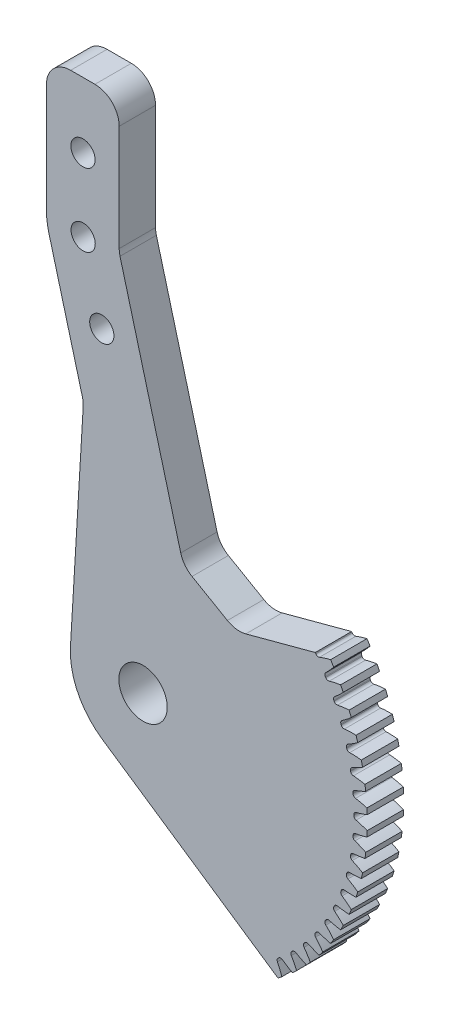
from build123d import *

# Parameters (mm, degrees)
SKETCH2_R                   = 60.325
BOSS_EXTRUDE2_DEPTH         = 4.7625
BOSS_EXTRUDE3_DEPTH         = 9.525
SKETCH4_W                   = 19.05
SKETCH4_H                   = 34.925
BOSS_EXTRUDE4_DEPTH         = 9.525
BOSS_EXTRUDE5_DEPTH         = 9.525
F_1_2_0_5_DIAMETER_HOLE1_D  = 12.6746
CUT_EXTRUDE1_DEPTH          = 146.316463062
CUT_EXTRUDE2_DEPTH          = 146.316463062
CUT_EXTRUDE3_DEPTH          = 12.7
F_1_4_0_25_DIAMETER_HOLE1_D = 6.35
FILLET1_R                   = 6.35
CUT_EXTRUDE4_DEPTH          = 1.5875
CUT_EXTRUDE5_DEPTH          = 1.5875
FILLET2_R                   = 0.79375


with BuildPart() as part:
    # Sketch2 → Boss-Extrude2 (new, symmetric)
    with BuildSketch(Plane.XY):
        with Locations(Location((0, 0, 0), (0, 0, 180))):
            Circle(SKETCH2_R)
    extrude(amount=BOSS_EXTRUDE2_DEPTH, both=True)

    # Sketch3 → Boss-Extrude3 (add)
    with BuildSketch(Plane.XY.offset(4.7625)):
        with BuildLine():
            Line((-15.613258896, 58.269475471), (-24.652514046, 92.004434954))
            Line((-24.652514046, 92.004434954), (-6.251627055, 96.934937763))
            Line((-6.251627055, 96.934937763), (3.586569747, 60.218287442))
            ThreePointArc((3.586569747, 60.218287442), (-6.091779707, 60.016629737), (-15.613258896, 58.269475471))
        make_face()
    extrude(amount=-BOSS_EXTRUDE3_DEPTH)



with BuildPart() as body_2:
    # Sketch4 → Boss-Extrude4 (new body)
    with BuildSketch(Plane.XY.offset(4.7625)):
        with Locations((-15.776627055, 114.397437763)):
            Rectangle(SKETCH4_W, SKETCH4_H)
    extrude(amount=-BOSS_EXTRUDE4_DEPTH)


with BuildPart() as part_1:
    add(part.part)

    add(body_2.part)  # Boss-Extrude5 merges body 2
    # Sketch5 → Boss-Extrude5 (add)
    with BuildSketch(Plane.XY.offset(4.7625)):
        with BuildLine():
            Line((-25.301627055, 96.934937763), (-6.251627055, 96.934937763))
            Line((-6.251627055, 96.934937763), (-24.652514046, 92.004434954))
            ThreePointArc((-24.652514046, 92.004434954), (-25.138651664, 94.448413801), (-25.301627055, 96.934937763))
        make_face()
    extrude(amount=-BOSS_EXTRUDE5_DEPTH)

    # 1/2 (0.5) Diameter Hole1 (through all)
    with Locations(Plane.XY.offset(4.7625)):
        with Locations((0, 0)):
            Hole(F_1_2_0_5_DIAMETER_HOLE1_D / 2)

    # Sketch8 → Cut-Extrude1 (cut, through all)
    with BuildSketch(Plane.XY.offset(4.7625)):
        with BuildLine():
            Line((24.377047427, 26.253821409), (50.357281824, 33.215204234))
            ThreePointArc((50.357281824, 33.215204234), (30.1625, 52.242982483), (3.586569747, 60.218287442))
            Line((3.586569747, 60.218287442), (10.547952573, 34.238053046))
            Line((10.547952573, 34.238053046), (24.377047427, 26.253821409))
        make_face()
    extrude(amount=-CUT_EXTRUDE1_DEPTH, mode=Mode.SUBTRACT)

    # Sketch9 → Cut-Extrude2 (cut, through all)
    with BuildSketch(Plane.XY.offset(4.7625)):
        with BuildLine():
            Line((-15.613258896, 58.269475471), (-19.016301297, 1.132600973))
            ThreePointArc((-19.016301297, 1.132600973), (-17.085425726, -8.425599549), (-10.677837987, -15.776129941))
            Line((-10.677837987, -15.776129941), (36.723533205, -47.859040253))
            ThreePointArc((36.723533205, -47.859040253), (-54.103848133, -26.681065237), (-15.613258896, 58.269475471))
        make_face()
    extrude(amount=-CUT_EXTRUDE2_DEPTH, mode=Mode.SUBTRACT)

    # Sketch10 → Cut-Extrude3 (cut)
    with BuildSketch(Plane.XY.offset(4.7625)):
        with BuildLine():
            Line((23.419033769, -49.979481499), (23.233039333, -50.066212129))
            ThreePointArc((23.233039333, -50.066212129), (22.859764861, -50.426162423), (22.788401381, -50.939782223))
            ThreePointArc((22.788401381, -50.939782223), (23.033501885, -52.449235123), (23.176311309, -53.971775034))
            ThreePointArc((23.176311309, -53.971775034), (22.477868108, -54.266374041), (21.775681229, -54.551935009))
            ThreePointArc((21.775681229, -54.551935009), (20.800064445, -53.374355201), (19.906032292, -52.133698591))
            ThreePointArc((19.906032292, -52.133698591), (19.492386647, -51.820976148), (18.973918443, -51.830397765))
            Line((18.973918443, -51.830397765), (18.781072699, -51.900587876))
            ThreePointArc((18.781072699, -51.900587876), (18.377846913, -52.226635436), (18.261990078, -52.732081021))
            ThreePointArc((18.261990078, -52.732081021), (18.374600412, -54.257151913), (18.384168307, -55.786344762))
            ThreePointArc((18.384168307, -55.786344762), (17.662706898, -56.018949394), (16.938303774, -56.242224098))
            ThreePointArc((16.938303774, -56.242224098), (16.069032349, -54.984094731), (15.286532607, -53.670239159))
            ThreePointArc((15.286532607, -53.670239159), (14.901716566, -53.322655125), (14.384400142, -53.286853409))
            Line((14.384400142, -53.286853409), (14.186170762, -53.339968811))
            ThreePointArc((14.186170762, -53.339968811), (13.756062455, -53.629632219), (13.596594005, -54.123056843))
            ThreePointArc((13.596594005, -54.123056843), (13.575857136, -55.652139017), (13.452110683, -57.176346722))
            Line((13.452110683, -57.176346722), (12.713121824, -57.345186719))
            Line((12.713121824, -57.345186719), (13.743915485, -61.994796452))
            ThreePointArc((13.743915485, -61.994796452), (60.561026372, -19.094818269), (46.817110887, 42.899978184))
            Line((46.817110887, 42.899978184), (43.30582757, 39.68247982))
            Line((43.30582757, 39.68247982), (43.814329162, 39.120307595))
            ThreePointArc((43.814329162, 39.120307595), (43.041446698, 37.800771687), (42.181387842, 36.536326718))
            ThreePointArc((42.181387842, 36.536326718), (42.029000012, 36.040669584), (42.215180006, 35.556691222))
            Line((42.215180006, 35.556691222), (42.347094264, 35.399481931))
            ThreePointArc((42.347094264, 35.399481931), (42.791390091, 35.132088469), (43.305978949, 35.196091227))
            ThreePointArc((43.305978949, 35.196091227), (44.70056181, 35.823515292), (46.134260634, 36.355520928))
            ThreePointArc((46.134260634, 36.355520928), (46.599591824, 35.757124437), (47.057161875, 35.152772613))
            ThreePointArc((47.057161875, 35.152772613), (46.172215331, 33.905619084), (45.205225619, 32.720944779))
            ThreePointArc((45.205225619, 32.720944779), (45.010218305, 32.240455244), (45.153508334, 31.742091909))
            Line((45.153508334, 31.742091909), (45.271218927, 31.573983761))
            ThreePointArc((45.271218927, 31.573983761), (45.690519198, 31.268884879), (46.208728098, 31.287794713))
            ThreePointArc((46.208728098, 31.287794713), (47.65268776, 31.791285335), (49.127298273, 32.196311443))
            ThreePointArc((49.127298273, 32.196311443), (49.538705047, 31.559635745), (49.941861175, 30.917703804))
            ThreePointArc((49.941861175, 30.917703804), (48.951585527, 29.752424244), (47.885024334, 28.656536689))
            ThreePointArc((47.885024334, 28.656536689), (47.648881659, 28.19487157), (47.7481912, 27.685916109))
            Line((47.7481912, 27.685916109), (47.850802277, 27.508188511))
            ThreePointArc((47.850802277, 27.508188511), (48.241915865, 27.167706196), (48.759800924, 27.141379191))
            ThreePointArc((48.759800924, 27.141379191), (50.242147983, 27.517104501), (51.746447509, 27.792068588))
            ThreePointArc((51.746447509, 27.792068588), (52.100798813, 27.12195917), (52.446472754, 26.447332603))
            ThreePointArc((52.446472754, 26.447332603), (51.358404599, 25.372795493), (50.200389099, 24.374035054))
            ThreePointArc((50.200389099, 24.374035054), (49.924908252, 23.934707899), (49.979481499, 23.419033771))
            Line((49.979481499, 23.419033771), (50.066212129, 23.233039335))
            ThreePointArc((50.066212129, 23.233039335), (50.426162422, 22.859764862), (50.939782223, 22.788401383))
            ThreePointArc((50.939782223, 22.788401383), (52.449235122, 23.033501886), (53.971775034, 23.176311309))
            ThreePointArc((53.971775034, 23.176311309), (54.266374041, 22.477868108), (54.551935009, 21.775681229))
            ThreePointArc((54.551935009, 21.775681229), (53.374355201, 20.800064445), (52.133698591, 19.906032292))
            ThreePointArc((52.133698591, 19.906032292), (51.820976148, 19.492386648), (51.830397765, 18.973918444))
            Line((51.830397765, 18.973918444), (51.900587876, 18.781072699))
            ThreePointArc((51.900587876, 18.781072699), (52.226635436, 18.377846913), (52.732081021, 18.261990078))
            ThreePointArc((52.732081021, 18.261990078), (54.257151913, 18.374600412), (55.786344761, 18.384168307))
            ThreePointArc((55.786344761, 18.384168307), (56.018949394, 17.662706898), (56.242224097, 16.938303774))
            ThreePointArc((56.242224097, 16.938303774), (54.984094731, 16.069032349), (53.670239158, 15.286532607))
            ThreePointArc((53.670239158, 15.286532607), (53.322655125, 14.901716566), (53.286853409, 14.384400142))
            Line((53.286853409, 14.384400142), (53.339968811, 14.186170762))
            ThreePointArc((53.339968811, 14.186170762), (53.629632219, 13.756062455), (54.123056842, 13.596594005))
            ThreePointArc((54.123056842, 13.596594005), (55.652139016, 13.575857136), (57.176346722, 13.452110683))
            ThreePointArc((57.176346722, 13.452110683), (57.345186718, 12.713121824), (57.504475902, 11.9720156))
            ThreePointArc((57.504475902, 11.9720156), (56.1753721, 11.215705215), (54.798316797, 10.550693178))
            ThreePointArc((54.798316797, 10.550693178), (54.418516498, 10.197635423), (54.337763921, 9.685407869))
            Line((54.337763921, 9.685407869), (54.373400374, 9.483303501))
            ThreePointArc((54.373400374, 9.483303501), (54.624475117, 9.029586056), (55.102123519, 8.827719642))
            ThreePointArc((55.102123519, 8.827719642), (56.623579737, 8.67379339), (58.131202157, 8.417674375))
            ThreePointArc((58.131202157, 8.417674375), (58.234992544, 7.666782215), (58.32908392, 6.914613157))
            ThreePointArc((58.32908392, 6.914613157), (56.939120968, 6.27701979), (55.50934616, 5.734556603))
            ThreePointArc((55.50934616, 5.734556603), (55.100220105, 5.415944117), (54.975131243, 4.912703794))
            Line((54.975131243, 4.912703794), (54.993017532, 4.708262572))
            ThreePointArc((54.993017532, 4.708262572), (55.203592778, 4.234389054), (55.661829767, 3.991661001))
            ThreePointArc((55.661829767, 3.991661001), (57.164080827, 3.705716838), (58.643644045, 3.319174481))
            ThreePointArc((58.643644045, 3.319174481), (58.681594914, 2.562093766), (58.709772392, 1.804586335))
            ThreePointArc((58.709772392, 1.804586335), (57.269528744, 1.290562457), (55.797915879, 0.874776591))
            ThreePointArc((55.797915879, 0.874776591), (55.362577764, 0.593034207), (55.194104619, 0.102611078))
            Line((55.194104619, 0.102611078), (55.194104619, -0.102611077))
            ThreePointArc((55.194104619, -0.102611077), (55.362577764, -0.593034206), (55.797915879, -0.87477659))
            ThreePointArc((55.797915879, -0.87477659), (57.269528744, -1.290562456), (58.709772391, -1.804586334))
            ThreePointArc((58.709772391, -1.804586334), (58.681594914, -2.562093766), (58.643644045, -3.319174482))
            ThreePointArc((58.643644045, -3.319174482), (57.164080827, -3.705716839), (55.661829767, -3.991661001))
            ThreePointArc((55.661829767, -3.991661001), (55.203592778, -4.234389054), (54.993017532, -4.708262572))
            Line((54.993017532, -4.708262572), (54.975131243, -4.912703796))
            ThreePointArc((54.975131243, -4.912703796), (55.100220104, -5.415944117), (55.509346158, -5.734556604))
            ThreePointArc((55.509346158, -5.734556604), (56.939120967, -6.277019791), (58.329083921, -6.914613157))
            ThreePointArc((58.329083921, -6.914613157), (58.234992544, -7.666782215), (58.131202157, -8.417674373))
            ThreePointArc((58.131202157, -8.417674373), (56.623579737, -8.673793389), (55.10212352, -8.82771964))
            ThreePointArc((55.10212352, -8.82771964), (54.624475118, -9.029586055), (54.373400376, -9.483303499))
            Line((54.373400376, -9.483303499), (54.337763922, -9.685407871))
            ThreePointArc((54.337763922, -9.685407871), (54.418516499, -10.197635424), (54.798316797, -10.550693179))
            ThreePointArc((54.798316797, -10.550693179), (56.175372099, -11.215705215), (57.504475901, -11.9720156))
            ThreePointArc((57.504475901, -11.9720156), (57.345186717, -12.713121823), (57.176346721, -13.452110683))
            ThreePointArc((57.176346721, -13.452110683), (55.652139016, -13.575857136), (54.123056842, -13.596594005))
            ThreePointArc((54.123056842, -13.596594005), (53.629632219, -13.756062456), (53.339968811, -14.186170763))
            Line((53.339968811, -14.186170763), (53.286853409, -14.384400143))
            ThreePointArc((53.286853409, -14.384400143), (53.322655125, -14.901716567), (53.670239157, -15.286532608))
            ThreePointArc((53.670239157, -15.286532608), (54.98409473, -16.06903235), (56.242224097, -16.938303774))
            ThreePointArc((56.242224097, -16.938303774), (56.018949394, -17.662706898), (55.786344761, -18.384168307))
            ThreePointArc((55.786344761, -18.384168307), (54.257151913, -18.374600413), (52.732081021, -18.261990079))
            ThreePointArc((52.732081021, -18.261990079), (52.226635436, -18.377846914), (51.900587876, -18.7810727))
            Line((51.900587876, -18.7810727), (51.830397765, -18.973918446))
            ThreePointArc((51.830397765, -18.973918446), (51.820976147, -19.49238665), (52.133698591, -19.906032294))
            ThreePointArc((52.133698591, -19.906032294), (53.3743552, -20.800064446), (54.551935009, -21.77568123))
            ThreePointArc((54.551935009, -21.77568123), (54.26637404, -22.477868109), (53.971775034, -23.17631131))
            ThreePointArc((53.971775034, -23.17631131), (52.449235122, -23.033501886), (50.939782222, -22.788401382))
            ThreePointArc((50.939782222, -22.788401382), (50.426162422, -22.859764862), (50.066212128, -23.233039334))
            Line((50.066212128, -23.233039334), (49.979481498, -23.419033771))
            ThreePointArc((49.979481498, -23.419033771), (49.924908251, -23.934707899), (50.200389098, -24.374035054))
            ThreePointArc((50.200389098, -24.374035054), (51.358404598, -25.372795492), (52.446472755, -26.447332602))
            ThreePointArc((52.446472755, -26.447332602), (52.100798813, -27.12195917), (51.746447509, -27.792068588))
            ThreePointArc((51.746447509, -27.792068588), (50.242147983, -27.5171045), (48.759800924, -27.141379189))
            ThreePointArc((48.759800924, -27.141379189), (48.241915865, -27.167706193), (47.850802277, -27.508188509))
            Line((47.850802277, -27.508188509), (47.748191198, -27.685916109))
            ThreePointArc((47.748191198, -27.685916109), (47.648881658, -28.19487157), (47.885024332, -28.65653669))
            ThreePointArc((47.885024332, -28.65653669), (48.951585526, -29.752424244), (49.941861175, -30.917703804))
            ThreePointArc((49.941861175, -30.917703804), (49.538705047, -31.559635745), (49.127298272, -32.196311444))
            ThreePointArc((49.127298272, -32.196311444), (47.652687759, -31.791285335), (46.208728097, -31.287794714))
            ThreePointArc((46.208728097, -31.287794714), (45.690519197, -31.268884879), (45.271218925, -31.573983761))
            Line((45.271218925, -31.573983761), (45.153508334, -31.742091908))
            ThreePointArc((45.153508334, -31.742091908), (45.010218305, -32.240455243), (45.205225619, -32.720944778))
            ThreePointArc((45.205225619, -32.720944778), (46.172215331, -33.905619083), (47.057161876, -35.152772612))
            ThreePointArc((47.057161876, -35.152772612), (46.599591825, -35.757124436), (46.134260634, -36.355520928))
            ThreePointArc((46.134260634, -36.355520928), (44.700561811, -35.823515291), (43.30597895, -35.196091226))
            ThreePointArc((43.30597895, -35.196091226), (42.791390092, -35.132088468), (42.347094265, -35.39948193))
            Line((42.347094265, -35.39948193), (42.215180006, -35.556691222))
            ThreePointArc((42.215180006, -35.556691222), (42.029000012, -36.040669585), (42.181387842, -36.536326719))
            ThreePointArc((42.181387842, -36.536326719), (43.041446698, -37.800771687), (43.814329162, -39.120307595))
            ThreePointArc((43.814329162, -39.120307595), (43.305827571, -39.68247982), (42.790113415, -40.238042947))
            ThreePointArc((42.790113415, -40.238042947), (41.408237595, -39.583106666), (40.073645153, -38.836524235))
            ThreePointArc((40.073645153, -38.836524235), (39.566592669, -38.727915652), (39.100682646, -38.955568668))
            Line((39.100682646, -38.955568668), (38.955568668, -39.100682646))
            ThreePointArc((38.955568668, -39.100682646), (38.727915652, -39.566592669), (38.836524235, -40.073645153))
            ThreePointArc((38.836524235, -40.073645153), (39.583106666, -41.408237595), (40.238042947, -42.790113415))
            ThreePointArc((40.238042947, -42.790113415), (39.68247982, -43.305827571), (39.120307595, -43.814329163))
            ThreePointArc((39.120307595, -43.814329163), (37.800771687, -43.041446699), (36.536326719, -42.181387843))
            ThreePointArc((36.536326719, -42.181387843), (36.040669585, -42.029000013), (35.556691222, -42.215180007))
            Line((35.556691222, -42.215180007), (35.39948193, -42.347094266))
            ThreePointArc((35.39948193, -42.347094266), (35.132088468, -42.791390093), (35.196091226, -43.305978951))
            ThreePointArc((35.196091226, -43.305978951), (35.823515291, -44.700561812), (36.355520929, -46.134260635))
            ThreePointArc((36.355520929, -46.134260635), (35.757124436, -46.599591826), (35.152772612, -47.057161878))
            ThreePointArc((35.152772612, -47.057161878), (33.905619082, -46.172215333), (32.720944776, -45.20522562))
            ThreePointArc((32.720944776, -45.20522562), (32.240455241, -45.010218306), (31.742091907, -45.153508335))
            Line((31.742091907, -45.153508335), (31.57398376, -45.271218926))
            ThreePointArc((31.57398376, -45.271218926), (31.268884878, -45.690519198), (31.287794713, -46.208728098))
            ThreePointArc((31.287794713, -46.208728098), (31.791285334, -47.65268776), (32.196311443, -49.127298273))
            ThreePointArc((32.196311443, -49.127298273), (31.559635745, -49.538705048), (30.917703804, -49.941861175))
            ThreePointArc((30.917703804, -49.941861175), (29.752424244, -48.951585527), (28.656536689, -47.885024334))
            ThreePointArc((28.656536689, -47.885024334), (28.194871569, -47.64888166), (27.685916109, -47.7481912))
            Line((27.685916109, -47.7481912), (27.508188507, -47.850802279))
            ThreePointArc((27.508188507, -47.850802279), (27.167706192, -48.241915867), (27.141379187, -48.759800926))
            ThreePointArc((27.141379187, -48.759800926), (27.517104499, -50.242147984), (27.792068588, -51.74644751))
            ThreePointArc((27.792068588, -51.74644751), (27.121959169, -52.100798815), (26.447332602, -52.446472756))
            ThreePointArc((26.447332602, -52.446472756), (25.372795491, -51.3584046), (24.374035052, -50.2003891))
            ThreePointArc((24.374035052, -50.2003891), (23.934707897, -49.924908253), (23.419033769, -49.979481499))
        make_face()
    extrude(amount=-CUT_EXTRUDE3_DEPTH, mode=Mode.SUBTRACT)

    # 1/4 (0.25) Diameter Hole1 (through all)
    with Locations(Plane.XY.offset(4.7625)):
        with Locations((-15.738059326, 114.741675782), (-15.69513936, 95.691675782), (-10.806106463, 77.279727017)):
            Hole(F_1_4_0_25_DIAMETER_HOLE1_D / 2)

    # Fillet1
    fillet1_edges = [part_1.edges().sort_by_distance(p)[0] for p in [
        (-6.251627055, 131.859937763, 0),
        (-25.301627055, 131.859937763, 0),
        (24.377047427, 26.253821409, 0),
        (10.547952573, 34.238053046, 0),
        (-15.613258896, 58.269475471, 0),
        (-6.251627055, 96.934937763, 0),
    ]]
    fillet(fillet1_edges, radius=FILLET1_R)

    # Sketch13 → Cut-Extrude4 (cut)
    with BuildSketch(Plane.XY.offset(-4.7625)):
        with BuildLine():
            Line((25.4, 1.6002), (50.8, 1.6002))
            ThreePointArc((50.8, 1.6002), (52.4002, 0), (50.8, -1.6002))
            Line((50.8, -1.6002), (25.4, -1.6002))
            ThreePointArc((25.4, -1.6002), (23.7998, 0), (25.4, 1.6002))
        make_face()
    extrude(amount=CUT_EXTRUDE4_DEPTH, mode=Mode.SUBTRACT)

    # Sketch14 → Cut-Extrude5 (cut)
    with BuildSketch(Plane.XY.offset(-4.7625)):
        with BuildLine():
            Line((42.007692308, 25.4), (38.107632212, 25.4))
            add(Edge.make_bspline(
                [(38.107632212, 25.4), (37.857033272, 25.399394073), (37.377431834, 25.398234436), (36.689241774, 25.386065636), (36.06438351, 25.369949139), (35.502384783, 25.33628411), (35.001740632, 25.306568481), (34.56461642, 25.257694596), (34.188954131, 25.214104381), (33.963094337, 25.166146393), (33.86030649, 25.144320913)],
                knots=[0, 0, 0, 0, 1.411347063, 2.701065231, 3.876524531, 4.931206492, 5.871916627, 6.700262025, 7.408494688, 8, 8, 8, 8], degree=3))
            add(Edge.make_bspline(
                [(33.86030649, 25.144320913), (33.70704198, 25.105792151), (33.405087549, 25.029884619), (32.97006223, 24.880438779), (32.559359388, 24.704252854), (32.173520335, 24.502295876), (31.811617359, 24.273553444), (31.48065207, 24.011124929), (31.167586413, 23.728415425), (30.884499987, 23.416555233), (30.626934154, 23.08492874), (30.406708625, 22.733594394), (30.217753179, 22.367270624), (30.060048587, 21.986501977), (29.94213026, 21.58704233), (29.859535305, 21.171831644), (29.802692742, 20.742103075), (29.798347369, 20.449425053), (29.796153846, 20.301682692)],
                knots=[0, 0, 0, 0, 1.103820101, 2.174693741, 3.209859002, 4.223626675, 5.214778413, 6.196198804, 7.171320727, 8.158999421, 9.134971582, 10.10159085, 11.051641808, 12.012235658, 12.97676874, 13.956376421, 14.968389326, 16, 16, 16, 16], degree=3))
            add(Edge.make_bspline(
                [(29.796153846, 20.301682692), (29.804319524, 20.058022605), (29.820367838, 19.579148216), (29.966215205, 18.880745757), (30.20521803, 18.222399152), (30.477825526, 17.708114557), (30.743023603, 17.325775399), (30.965052556, 17.053961588), (31.209149276, 16.799314001), (31.473582968, 16.559181508), (31.765312609, 16.344175735), (32.075438564, 16.140316614), (32.407619191, 15.952912587), (32.886439767, 15.727887575), (33.534072655, 15.49334805), (34.370863838, 15.292276936), (35.275080079, 15.170140178), (35.900263727, 15.151773606), (36.222475962, 15.142307692)],
                knots=[0, 0, 0, 0, 1.258986715, 2.474334223, 3.670931197, 4.871716255, 5.472099774, 6.075216246, 6.684756624, 7.295006596, 7.919971941, 8.55677058, 9.213641309, 9.890468445, 11.291088691, 12.766994829, 14.333747493, 16, 16, 16, 16], degree=3))
            Line((36.222475962, 15.142307692), (29.551923077, 6.35))
            Line((29.551923077, 6.35), (32.242277644, 6.35))
            Line((32.242277644, 6.35), (38.912830529, 15.142307692))
            Line((38.912830529, 15.142307692), (39.565384615, 15.142307692))
            Line((39.565384615, 15.142307692), (39.565384615, 6.35))
            Line((39.565384615, 6.35), (42.007692308, 6.35))
            Line((42.007692308, 6.35), (42.007692308, 25.4))
        make_face()
        with BuildLine():
            Line((39.565384615, 23.201923077), (39.565384615, 17.33656851))
            Line((39.565384615, 17.33656851), (36.764362981, 17.317487981))
            add(Edge.make_bspline(
                [(36.764362981, 17.317487981), (36.614248757, 17.317875845), (36.324110083, 17.318625503), (35.904139381, 17.334061958), (35.514606415, 17.359910747), (35.157049873, 17.398194341), (34.832506846, 17.443867956), (34.53848961, 17.49502279), (34.277758928, 17.564098146), (33.973192748, 17.663667763), (33.634815888, 17.823635769), (33.27586075, 18.067193704), (32.961223901, 18.355438548), (32.703205389, 18.693186513), (32.496762992, 19.063733222), (32.346580868, 19.459365589), (32.256112285, 19.87785357), (32.24441209, 20.163857436), (32.238461538, 20.309314904)],
                knots=[0, 0, 0, 0, 1.165824803, 2.253289887, 3.263370799, 4.197285623, 5.045371766, 5.808848116, 6.513348392, 7.138183875, 8.296069948, 9.40583476, 10.496436725, 11.595152671, 12.691956992, 13.780050175, 14.870965332, 16, 16, 16, 16], degree=3))
            add(Edge.make_bspline(
                [(32.238461538, 20.309314904), (32.2446936, 20.449629298), (32.257054659, 20.727937623), (32.344971818, 21.136390579), (32.502121069, 21.521726263), (32.710622356, 21.883449352), (32.968965533, 22.208634959), (33.266066086, 22.49517958), (33.609278845, 22.722306075), (33.925258141, 22.875601192), (34.208444957, 22.971742136), (34.459195027, 23.031114739), (34.744605907, 23.083539222), (35.065260751, 23.129615925), (35.420566945, 23.163280044), (35.81141078, 23.184459154), (36.237599385, 23.2010999), (36.534105791, 23.201641762), (36.688040865, 23.201923077)],
                knots=[0, 0, 0, 0, 1.114111647, 2.20979856, 3.297775031, 4.406653707, 5.514151176, 6.585969385, 7.670234779, 8.768154562, 9.365517569, 10.041721951, 10.812428959, 11.669578816, 12.61341719, 13.645562296, 14.777663698, 16, 16, 16, 16], degree=3))
            Line((36.688040865, 23.201923077), (39.565384615, 23.201923077))
        make_face(mode=Mode.SUBTRACT)
    extrude(amount=CUT_EXTRUDE5_DEPTH, mode=Mode.SUBTRACT)

    # Fillet2
    fillet2_edges = [part_1.edges().sort_by_distance(p)[0] for p in [
        (36.222475962, 15.142307692, -3.96875),
        (29.796153846, 20.301682692, -3.96875),
        (33.86030649, 25.144320913, -3.96875),
        (38.107632212, 25.4, -3.96875),
        (29.551923077, 6.35, -3.96875),
        (39.565384615, 23.201923077, -3.96875),
        (39.565384615, 17.33656851, -3.96875),
        (42.007692308, 25.4, -3.96875),
        (32.242277644, 6.35, -3.96875),
        (38.912830529, 15.142307692, -3.96875),
        (39.565384615, 6.35, -3.96875),
        (42.007692308, 6.35, -3.96875),
    ]]
    fillet(fillet2_edges, radius=FILLET2_R)


solid = part_1.part
